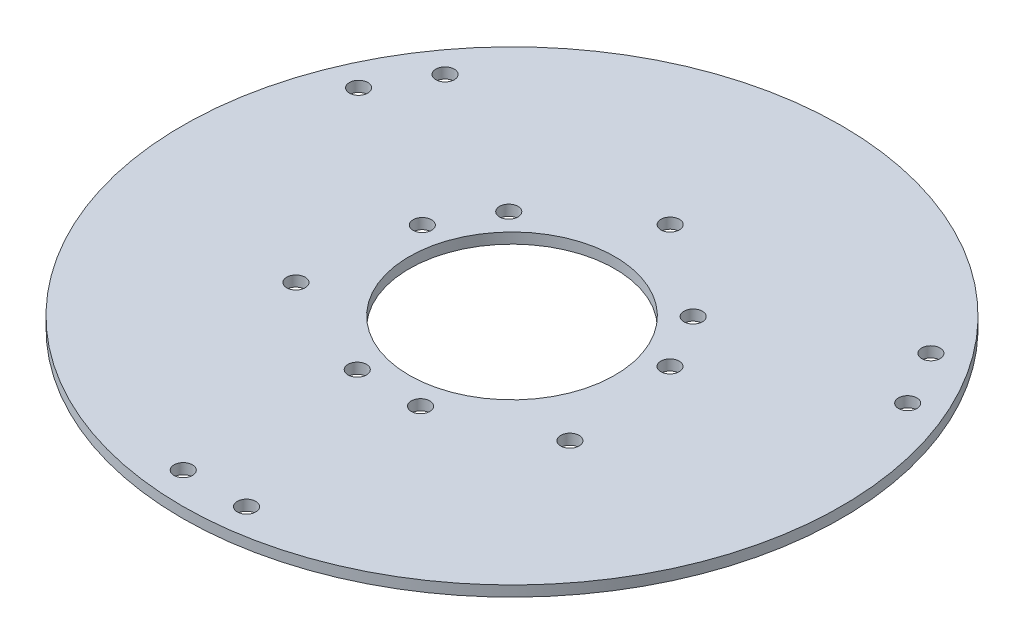
from build123d import *

# Parameters (mm, degrees)
SKETCH1_R           = 62.5
SKETCH1_R_2         = 1.75
SKETCH1_R_3         = 19.5
BOSS_EXTRUDE1_DEPTH = 2


with BuildPart() as part:
    # Sketch1 → Boss-Extrude1 (new body)
    with BuildSketch(Plane(origin=(0, 0, 0), x_dir=(1, 0, 0), z_dir=(0, 1, 0))):
        with Locations(Location((0, 0, 0), (0, 0, 270))):
            Circle(SKETCH1_R)
        with Locations(Location((6.153691309, -23.5, 0), (0, 0, 270))):
            Circle(SKETCH1_R_2, mode=Mode.SUBTRACT)
        with Locations(Location((-5.846308691, -23.5, 0), (0, 0, 270))):
            Circle(SKETCH1_R_2, mode=Mode.SUBTRACT)
        with Locations(Location((6.153691309, -56.5, 0), (0, 0, 270))):
            Circle(SKETCH1_R_2, mode=Mode.SUBTRACT)
        with Locations(Location((-5.846308691, -56.5, 0), (0, 0, 270))):
            Circle(SKETCH1_R_2, mode=Mode.SUBTRACT)
        with Locations(Location((-46.007280968, 33.313051845, 0), (0, 0, 270))):
            Circle(SKETCH1_R_2, mode=Mode.SUBTRACT)
        with Locations(Location((-23.428442643, 6.420747, 0), (0, 0, 270))):
            Circle(SKETCH1_R_2, mode=Mode.SUBTRACT)
        with Locations(Location((-17.428442643, 16.813051845, 0), (0, 0, 270))):
            Circle(SKETCH1_R_2, mode=Mode.SUBTRACT)
        with Locations(Location((-52.007280968, 22.920747, 0), (0, 0, 270))):
            Circle(SKETCH1_R_2, mode=Mode.SUBTRACT)
        with Locations(Location((51.853589659, 23.186948155, 0), (0, 0, 270))):
            Circle(SKETCH1_R_2, mode=Mode.SUBTRACT)
        with Locations(Location((17.274751335, 17.079253, 0), (0, 0, 270))):
            Circle(SKETCH1_R_2, mode=Mode.SUBTRACT)
        with Locations(Location((23.274751335, 6.686948155, 0), (0, 0, 270))):
            Circle(SKETCH1_R_2, mode=Mode.SUBTRACT)
        with Locations(Location((45.853589659, 33.579253, 0), (0, 0, 270))):
            Circle(SKETCH1_R_2, mode=Mode.SUBTRACT)
        with Locations(Location((0, 0, 0), (0, 0, 270))):
            Circle(SKETCH1_R_3, mode=Mode.SUBTRACT)
        with Locations(Location((0, 30, 0), (0, 0, 270))):
            Circle(SKETCH1_R_2, mode=Mode.SUBTRACT)
        with Locations(Location((25.980762114, -15, 0), (0, 0, 270))):
            Circle(SKETCH1_R_2, mode=Mode.SUBTRACT)
        with Locations(Location((-25.980762114, -15, 0), (0, 0, 270))):
            Circle(SKETCH1_R_2, mode=Mode.SUBTRACT)
    extrude(amount=BOSS_EXTRUDE1_DEPTH)


solid = part.part
